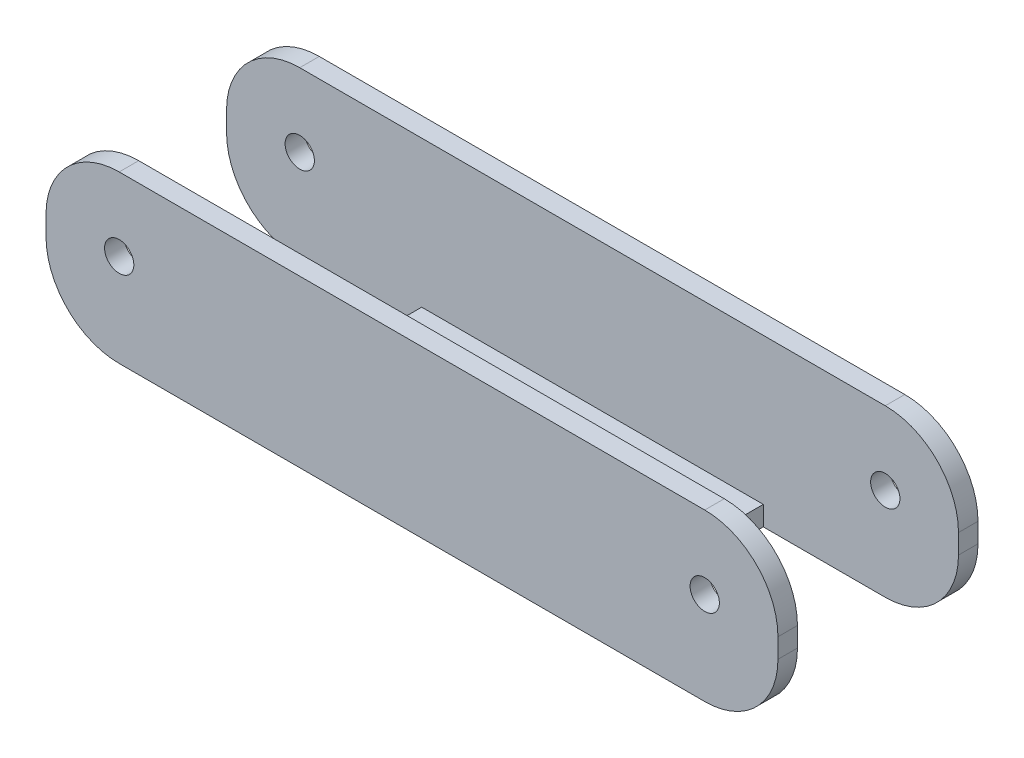
from build123d import *

# Parameters (mm, degrees)
EXTRUDE_1_DEPTH     = 150
SKETCH_2_R          = 3
CUT_EXTRUDE_1_DEPTH = 300
SKETCH_3_W          = 40
SKETCH_3_H          = 33
CUT_EXTRUDE_2_DEPTH = 10
FILLET_1_R          = 15


with BuildPart() as part:
    # 草图1 → 凸台-拉伸1 (new body)
    with BuildSketch(Plane(origin=(0, 0, 0), x_dir=(0, 0, -1), z_dir=(1, 0, 0))):
        Polygon((-16.5, 4), (-16.5, 34), (-20.5, 34), (-20.5, 0), (0, 0), (0, 4), align=None)
        Polygon((16.5, 4), (0, 4), (0, 0), (20.5, 0), (20.5, 34), (16.5, 34), align=None)
    extrude(amount=EXTRUDE_1_DEPTH)

    # 草图2 → 切除-拉伸1 (cut)
    with BuildSketch(Plane.XY.offset(20.5)):
        with Locations(Location((15, 19, 0), (0, 0, 90))):
            Circle(SKETCH_2_R)
        with Locations(Location((135, 19, 0), (0, 0, 90))):
            Circle(SKETCH_2_R)
    extrude(amount=-CUT_EXTRUDE_1_DEPTH, mode=Mode.SUBTRACT)

    # 草图3 → 切除-拉伸2 (cut)
    with BuildSketch(Plane.XZ):
        with Locations((130, 0)):
            Rectangle(SKETCH_3_W, SKETCH_3_H)
        with Locations((20, 0)):
            Rectangle(SKETCH_3_W, SKETCH_3_H)
    extrude(amount=-CUT_EXTRUDE_2_DEPTH, mode=Mode.SUBTRACT)

    # 圆角1
    fillet_1_edges = [part.edges().sort_by_distance(p)[0] for p in [
        (0, 0, 18.5),
        (0, 34, 18.5),
        (150, 34, 18.5),
        (150, 0, 18.5),
        (150, 34, -18.5),
        (150, 0, -18.5),
        (0, 0, -18.5),
        (0, 34, -18.5),
    ]]
    fillet(fillet_1_edges, radius=FILLET_1_R)


solid = part.part
